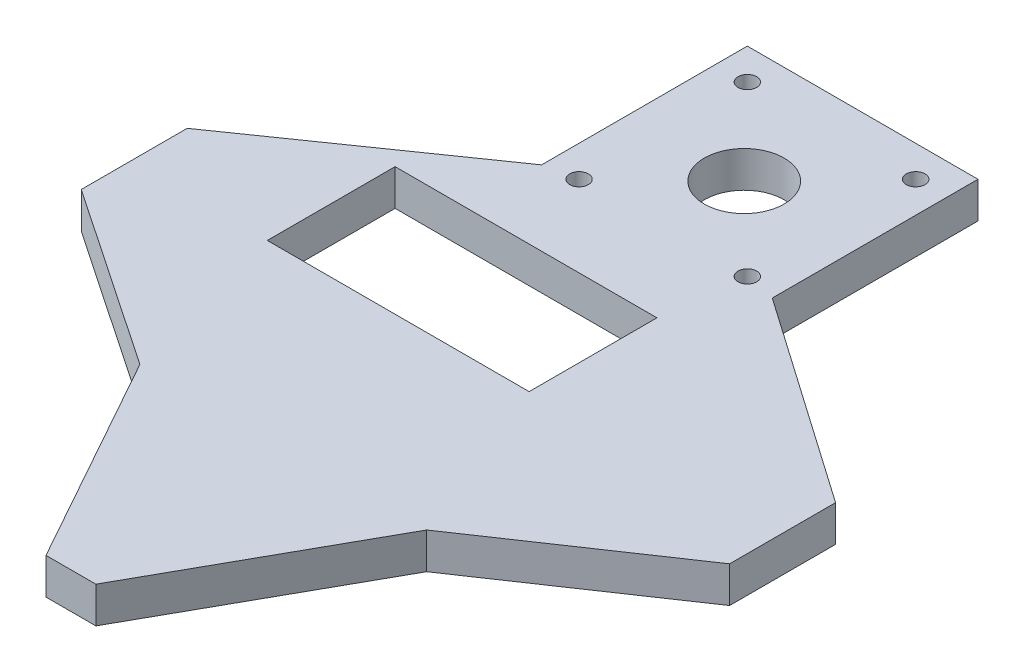
from build123d import *
from build123d.topology import SkipClean

# Parameters (mm, degrees)
BOSS_EXTRU_1_DEPTH      = 5.8
ESQUISSE2_R             = 1.5
ESQUISSE2_R_2           = 6.4
ENL_V_MAT_EXTRU_1_DEPTH = 5.8
ESQUISSE3_W             = 42
ESQUISSE3_H             = 20.5
ENL_V_MAT_EXTRU_2_DEPTH = 5.8


with BuildPart() as part:
    # Esquisse1 → Boss.-Extru.1 (new body)
    with BuildSketch(Plane(origin=(0, 0, 0), x_dir=(1, 0, 0), z_dir=(0, 1, 0))):
        Polygon((0, 0), (-18.5, 0), (-18.5, -33), (-52, -56.345309326), (-52, -73.345309326), (-23, -92.941227268), (-4, -127), (0, -127), align=None)
    boss_extru_1 = extrude(amount=BOSS_EXTRU_1_DEPTH)

    # Esquisse2 → Enlèv. mat.-Extru.1 (cut)
    with BuildSketch(Plane(origin=(0, 5.8, 0), x_dir=(1, 0, 0), z_dir=(0, 1, 0))):
        with Locations(Location((-13.5, -5, 0), (0, 0, 270))):
            Circle(ESQUISSE2_R)
        with Locations((0, -19)):
            Circle(ESQUISSE2_R_2)
        with Locations(Location((-13.5, -32, 0), (0, 0, 270))):
            Circle(ESQUISSE2_R)
    enl_v_mat_extru_1 = extrude(amount=-ENL_V_MAT_EXTRU_1_DEPTH, mode=Mode.SUBTRACT)

    # Symétrie2: Boss.-Extru.1, Enlèv. mat.-Extru.1 across plane
    with SkipClean():  # the faces are left unmerged after this step: merging them gives an invalid solid
        add(boss_extru_1.mirror(Plane(origin=(0, 5.8, 0), x_dir=(0, 0, 1), z_dir=(-1, 0, 0))))
        add(enl_v_mat_extru_1.mirror(Plane(origin=(0, 5.8, 0), x_dir=(0, 0, 1), z_dir=(-1, 0, 0))), mode=Mode.SUBTRACT)

    # Esquisse3 → Enlèv. mat.-Extru.2 (cut)
    with SkipClean():  # the faces are left unmerged after this step: merging them gives an invalid solid
        with BuildSketch(Plane(origin=(0, 5.8, 0), x_dir=(1, 0, 0), z_dir=(0, 1, 0))):
            with Locations((-9, -55.25)):
                Rectangle(ESQUISSE3_W, ESQUISSE3_H)
        extrude(amount=-ENL_V_MAT_EXTRU_2_DEPTH, mode=Mode.SUBTRACT)


solid = part.part
